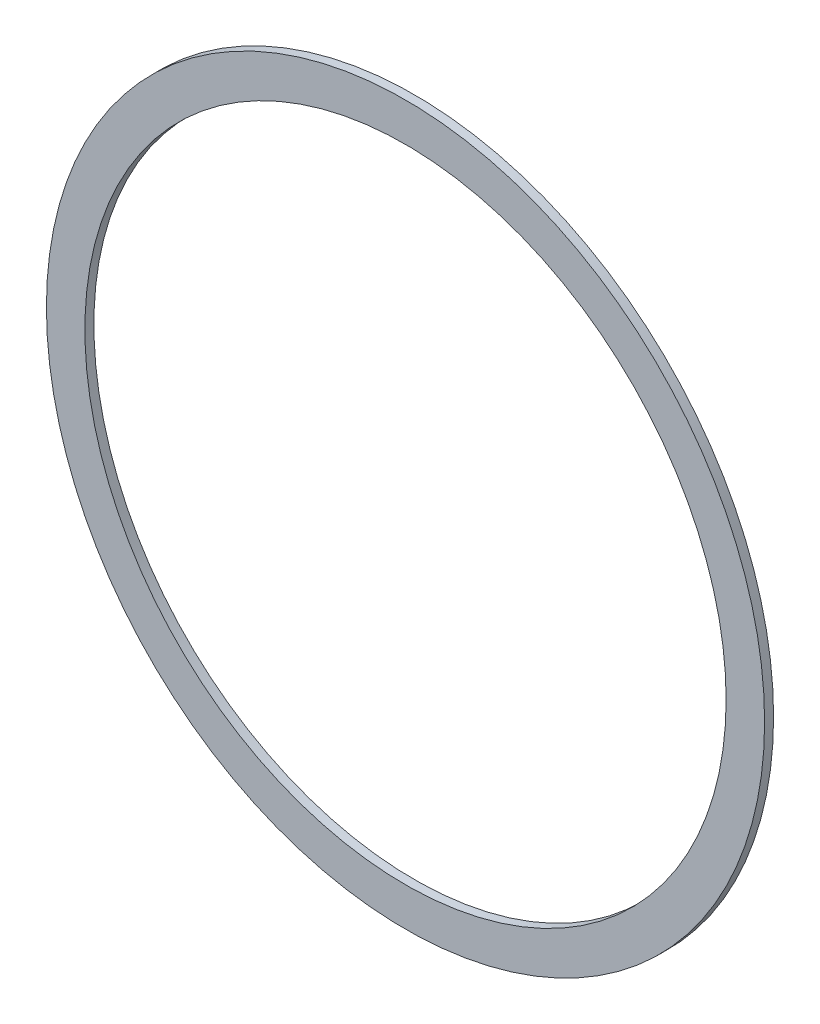
from build123d import *

# Parameters (mm, degrees)
SKETCH_1_W = 0.35
SKETCH_1_H = 1.5


with BuildPart() as part:
    # Эскиз1 → Повернуть1 (revolve)
    with BuildSketch(Plane(origin=(0, 0, 0), x_dir=(0, 0, -1), z_dir=(1, 0, 0)), mode=Mode.PRIVATE) as revolve_1_sk:
        with Locations((0.175, 13.25)):
            Rectangle(SKETCH_1_W, SKETCH_1_H)
    revolve(revolve_1_sk.sketch.rotate(Axis((0, 0, 0), (0, 0, -1)), 90), axis=Axis((0, 0, 0), (0, 0, -1)))


solid = part.part
